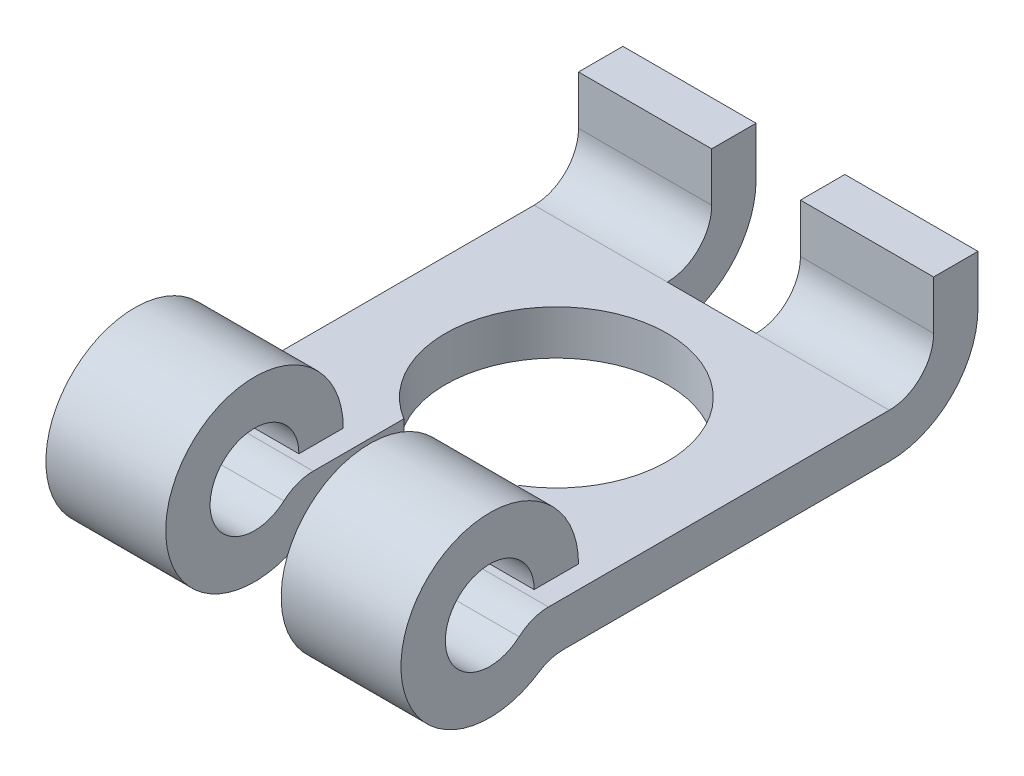
from build123d import *

# Parameters (mm, degrees)
BOSS_EXTRUDE7_DEPTH = 80
FILLET1_R           = 10
FILLET2_R           = 10
SKETCH3_W           = 20
SKETCH3_H           = 28.966426772
CUT_EXTRUDE1_DEPTH  = 40
FILLET4_R           = 20


with BuildPart() as part:
    # Sketch2 → Boss-Extrude7 (new body)
    with BuildSketch(Plane(origin=(0, 0, 0), x_dir=(0, 0, -1), z_dir=(1, 0, 0))):
        with BuildLine():
            ThreePointArc((-1.339745962, 10), (-19.659258263, 17.588190451), (0, 15))
            Line((0, 15), (10, 15))
            ThreePointArc((10, 15), (-28.228756555, 23.228756555), (3.228756555, 0))
            Line((3.228756555, 0), (90, 0))
            Line((90, 0), (100, 0))
            Line((100, 0), (100, 10))
            Line((100, 10), (100, 31))
            Line((100, 31), (90, 31))
            Line((90, 31), (90, 10))
            Line((90, 10), (20, 10))
            Line((20, 10), (10, 10))
            Line((10, 10), (-1.339745962, 10))
        make_face()
    extrude(amount=BOSS_EXTRUDE7_DEPTH)

    # Fillet1
    fillet1_edges = [part.edges().sort_by_distance(p)[0] for p in [
        (40, 10, -90),
    ]]
    fillet(fillet1_edges, radius=FILLET1_R)

    # Fillet2
    fillet2_edges = [part.edges().sort_by_distance(p)[0] for p in [
        (40, 10, 1.339745962),
        (40, 0, -3.228756555),
    ]]
    fillet(fillet2_edges, radius=FILLET2_R)

    # Sketch3 → Cut-Extrude1 (cut, symmetric)
    with BuildSketch(Plane(origin=(0, 0, 0), x_dir=(1, 0, 0), z_dir=(0, 1, 0))):
        with BuildLine():
            Line((53, 10), (53, 23.645843496))
            ThreePointArc((53, 23.645843496), (40, 70), (27, 23.645843496))
            Line((27, 23.645843496), (27, 10))
            Line((27, 10), (27, -31.662975448))
            Line((27, -31.662975448), (53, -31.662975448))
            Line((53, -31.662975448), (53, 10))
        make_face()
        with Locations((40, 94.483213386)):
            Rectangle(SKETCH3_W, SKETCH3_H)
    extrude(amount=CUT_EXTRUDE1_DEPTH, both=True, mode=Mode.SUBTRACT)

    # Fillet4
    fillet4_edges = [part.edges().sort_by_distance(p)[0] for p in [
        (15, 0, -100),
        (65, 0, -100),
    ]]
    fillet(fillet4_edges, radius=FILLET4_R)


solid = part.part
